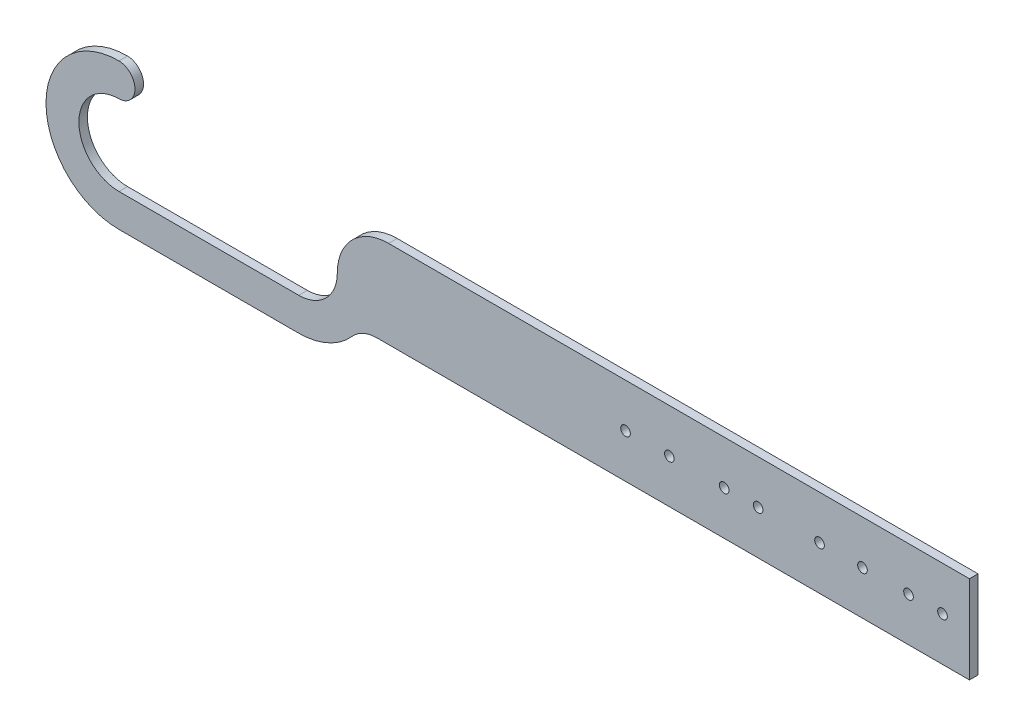
from build123d import *

# Parameters (mm, degrees)
BOSS_EXTRUDE1_DEPTH = 4.953
SKETCH4_W           = 52.07
SKETCH4_H           = 19.05
SKETCH4_R           = 9.528566475
BOSS_EXTRUDE4_DEPTH = 4.953
SKETCH5_R           = 2.794
CUT_EXTRUDE1_DEPTH  = 4.953


with BuildPart() as part:
    # Sketch1 → Boss-Extrude1 (new body)
    with BuildSketch(Plane.XY):
        with BuildLine():
            Line((-41.509205492, 38.23442277), (-41.509205492, -12.56557723))
            Line((-41.509205492, -12.56557723), (-20.563828914, -12.56557723))
            ThreePointArc((-20.563828914, -12.56557723), (-14.071874854, -2.900775285), (-11.791205492, 8.51642277))
            ThreePointArc((-11.791205492, 8.51642277), (-20.495406169, 29.530222094), (-41.509205492, 38.23442277))
        make_face()
        with BuildLine():
            Line((-62.45458207, -12.56557723), (-41.509205492, -12.56557723))
            Line((-41.509205492, -12.56557723), (-41.509205492, 38.23442277))
            ThreePointArc((-41.509205492, 38.23442277), (-62.523004816, 29.530222094), (-71.227205492, 8.51642277))
            ThreePointArc((-71.227205492, 8.51642277), (-68.946536131, -2.900775285), (-62.45458207, -12.56557723))
        make_face()
        with BuildLine():
            ThreePointArc((-11.791205492, 8.51642277), (-14.071874854, -2.900775285), (-20.563828914, -12.56557723))
            Line((-20.563828914, -12.56557723), (9.711739651, -12.56557723))
            Line((9.711739651, -12.56557723), (295.040794508, -12.56557723))
            Line((295.040794508, -12.56557723), (295.040794508, 38.23442277))
            Line((295.040794508, 38.23442277), (-41.509205492, 38.23442277))
            ThreePointArc((-41.509205492, 38.23442277), (-20.495406169, 29.530222094), (-11.791205492, 8.51642277))
        make_face()
        with BuildLine():
            Line((-71.227205492, -12.56557723), (-62.45458207, -12.56557723))
            ThreePointArc((-62.45458207, -12.56557723), (-68.946536131, -2.900775285), (-71.227205492, 8.51642277))
            Line((-71.227205492, 8.51642277), (-71.227205492, -12.56557723))
        make_face()
    extrude(amount=BOSS_EXTRUDE1_DEPTH)

    # Sketch4 → Boss-Extrude4 (add)
    with BuildSketch(Plane(origin=(0, 0, 0), x_dir=(-1, 0, 0), z_dir=(0, 0, -1))):
        with Locations((171.684205492, -23.36057723)):
            Rectangle(SKETCH4_W, SKETCH4_H)
        with BuildLine():
            Line((145.649205492, -13.83557723), (93.579205492, -13.83557723))
            ThreePointArc((93.579205492, -13.83557723), (77.773954719, -7.288828003), (71.227205492, 8.51642277))
            Line((71.227205492, 8.51642277), (71.227205492, -12.56557723))
            Line((71.227205492, -12.56557723), (48.370059515, -12.56557723))
            ThreePointArc((48.370059515, -12.56557723), (56.179798103, -14.24000578), (62.61663913, -18.968938574))
            ThreePointArc((62.61663913, -18.968938574), (76.606040295, -29.246485846), (93.579205492, -32.88557723))
            Line((93.579205492, -32.88557723), (145.649205492, -32.88557723))
            Line((145.649205492, -32.88557723), (145.649205492, -13.83557723))
        make_face()
        with BuildLine():
            ThreePointArc((206.26970661, 31.017935339), (220.549824511, 5.053937718), (197.719205492, -13.83557723))
            Line((197.719205492, -13.83557723), (197.719205492, -32.88557723))
            ThreePointArc((197.719205492, -32.88557723), (239.658720339, 3.959196789), (208.522432887, 50.294840539))
            Line((208.522432887, 50.294840539), (207.444047034, 41.066936521))
            Line((207.444047034, 41.066936521), (206.26970661, 31.017935339))
        make_face()
        with Locations((197.979885508, 42.172931859)):
            Circle(SKETCH4_R)
        with BuildLine():
            Line((207.444047034, 41.066936521), (208.522432887, 50.294840539))
            ThreePointArc((208.522432887, 50.294840539), (203.499658151, 51.301032243), (198.392077595, 51.69257874))
            ThreePointArc((198.392077595, 51.69257874), (204.861788543, 48.763302841), (207.508451983, 42.172931859))
            ThreePointArc((207.508451983, 42.172931859), (207.492337119, 41.618997367), (207.444047034, 41.066936521))
        make_face()
        with BuildLine():
            ThreePointArc((198.088987461, 32.644990012), (202.252933463, 32.201450179), (206.26970661, 31.017935339))
            Line((206.26970661, 31.017935339), (207.444047034, 41.066936521))
            ThreePointArc((207.444047034, 41.066936521), (204.355161122, 35.091304933), (198.088987461, 32.644990012))
        make_face()
    extrude(amount=-BOSS_EXTRUDE4_DEPTH)

    # Sketch5 → Cut-Extrude1 (cut)
    with BuildSketch(Plane(origin=(0, 0, 0), x_dir=(-1, 0, 0), z_dir=(0, 0, -1))):
        with Locations((-279.419794508, 12.83442277)):
            Circle(SKETCH5_R)
        with Locations((-259.734794508, 12.83442277)):
            Circle(SKETCH5_R)
        with Locations((-233.064794508, 12.83442277)):
            Circle(SKETCH5_R)
        with Locations((-208.172794508, 12.83442277)):
            Circle(SKETCH5_R)
        with Locations((-172.612794508, 12.83442277)):
            Circle(SKETCH5_R)
        with Locations((-152.927794508, 12.83442277)):
            Circle(SKETCH5_R)
        with Locations((-121.177794508, 12.83442277)):
            Circle(SKETCH5_R)
        with Locations((-95.777794508, 12.83442277)):
            Circle(SKETCH5_R)
    extrude(amount=-CUT_EXTRUDE1_DEPTH, mode=Mode.SUBTRACT)


solid = part.part
